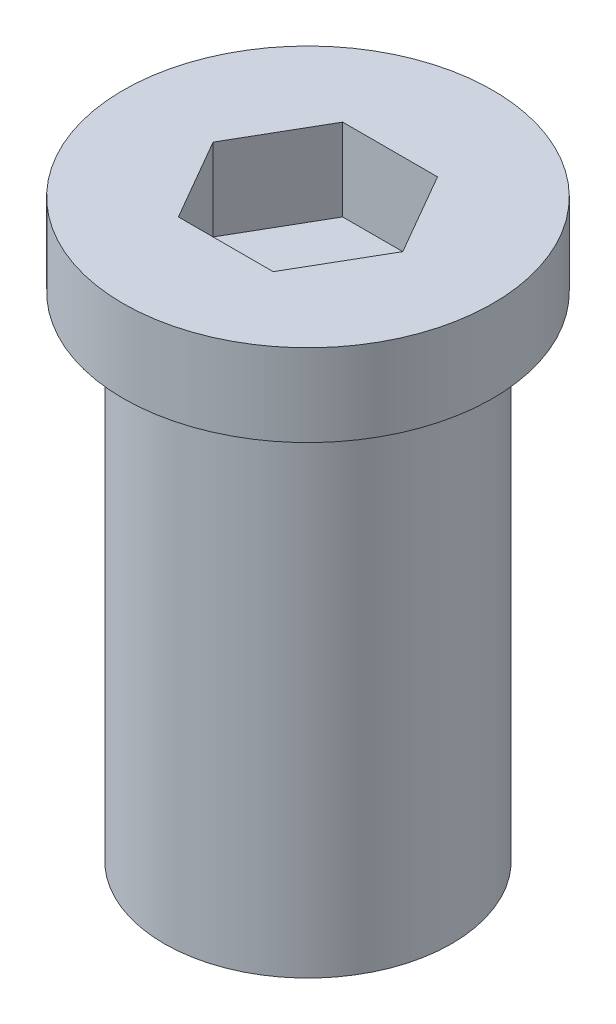
from build123d import *

# Parameters (mm, degrees)
SKETCH1_R           = 1.75
BOSS_EXTRUDE1_DEPTH = 3
SKETCH2_R           = 2.25
BOSS_EXTRUDE2_DEPTH = 1
CUT_EXTRUDE1_DEPTH  = 1


with BuildPart() as part:
    # Sketch1 → Boss-Extrude1 (new, symmetric)
    with BuildSketch(Plane(origin=(0, 0, 0), x_dir=(1, 0, 0), z_dir=(0, 1, 0))):
        with Locations(Location((0, 0, 0), (0, 0, 270))):
            Circle(SKETCH1_R)
    extrude(amount=BOSS_EXTRUDE1_DEPTH, both=True)

    # Sketch2 → Boss-Extrude2 (add)
    with BuildSketch(Plane(origin=(0, 3, 0), x_dir=(1, 0, 0), z_dir=(0, 1, 0))):
        with Locations(Location((0, 0, 0), (0, 0, 270))):
            Circle(SKETCH2_R)
    extrude(amount=BOSS_EXTRUDE2_DEPTH)

    # Sketch3 → Cut-Extrude1 (cut)
    with BuildSketch(Plane(origin=(0, 4, 0), x_dir=(1, 0, 0), z_dir=(0, 1, 0))):
        Polygon((1.154700538, 0), (0.577350269, 1), (-0.577350269, 1), (-1.154700538, 0), (-0.577350269, -1), (0.577350269, -1), align=None)
    extrude(amount=-CUT_EXTRUDE1_DEPTH, mode=Mode.SUBTRACT)


solid = part.part
